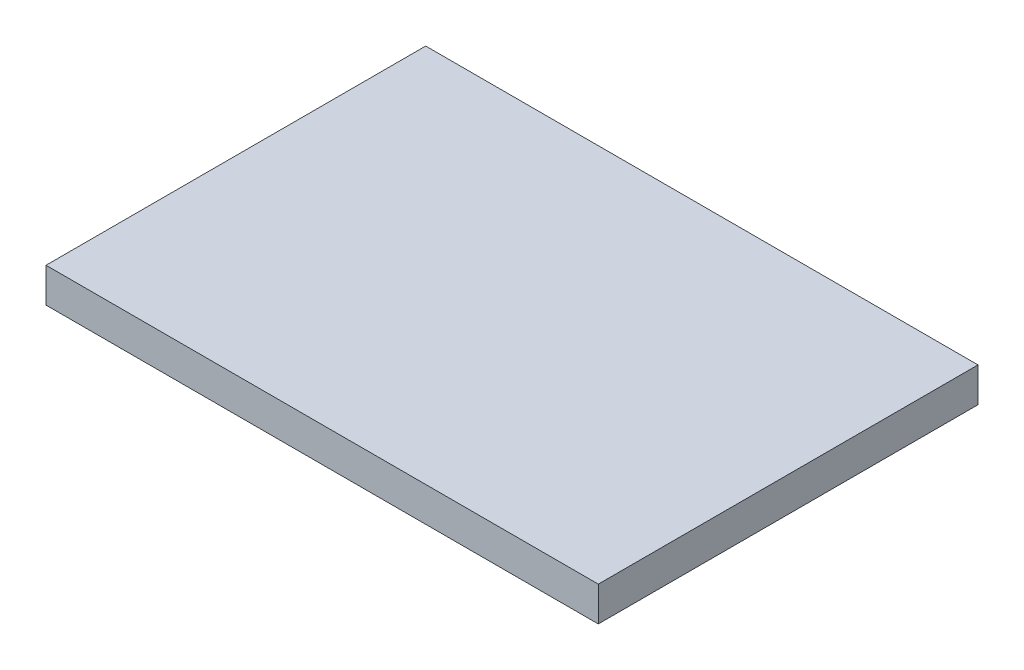
from build123d import *

# Parameters (mm, degrees)
SKETCH1_W           = 32
SKETCH1_H           = 22
BOSS_EXTRUDE1_DEPTH = 2


with BuildPart() as part:
    # Sketch1 → Boss-Extrude1 (new body)
    with BuildSketch(Plane(origin=(0, 0, 0), x_dir=(1, 0, 0), z_dir=(0, 1, 0))):
        Rectangle(SKETCH1_W, SKETCH1_H)
    extrude(amount=BOSS_EXTRUDE1_DEPTH)


solid = part.part
